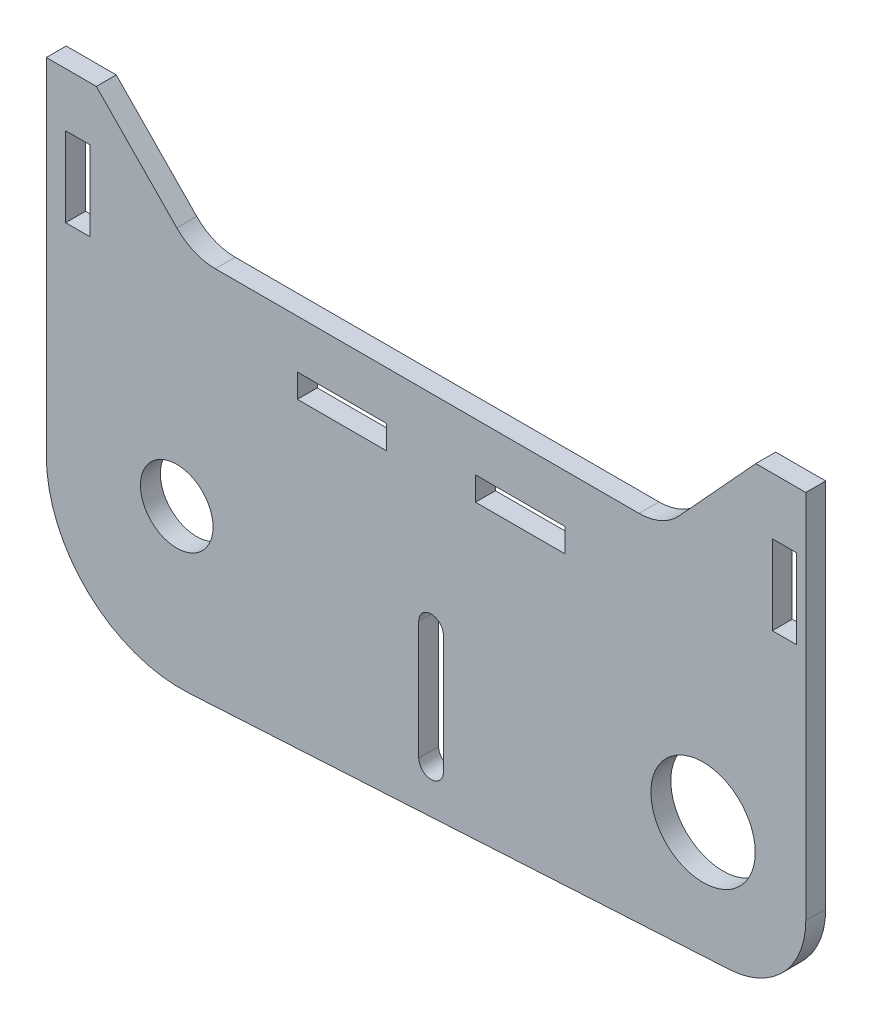
from build123d import *

# Parameters (mm, degrees)
SKETCH2_R           = 9.7
SKETCH2_R_2         = 6.75
SKETCH2_W           = 4.5
SKETCH2_H           = 14.8
SKETCH2_W_2         = 16.6
SKETCH2_H_2         = 4.4
BOSS_EXTRUDE1_DEPTH = 3.7
FILLET1_R           = 15
FILLET2_R           = 25
FILLET3_R           = 10


with BuildPart() as part:
    # Sketch2 → Boss-Extrude1 (new body)
    with BuildSketch(Plane.XY):
        Polygon((-66.408376963, -37.473298429), (-66.408376963, 53.126701571), (-57.108376963, 53.126701571), (-39.206701064, 34.826701571), (48.193298936, 34.826701571), (65.490462758, 53.699118578), (74.790462758, 53.699118578), (74.790462758, -29.400881422), align=None)
        with Locations((55.690462758, -8.957731732)):
            Circle(SKETCH2_R, mode=Mode.SUBTRACT)
        with Locations((-42.158376963, -6.98947646)):
            Circle(SKETCH2_R_2, mode=Mode.SUBTRACT)
        with Locations((-60.558376963, 35.726701571)):
            Rectangle(SKETCH2_W, SKETCH2_H, mode=Mode.SUBTRACT)
        with Locations((70.815419874, 35.726701571)):
            Rectangle(SKETCH2_W, SKETCH2_H, mode=Mode.SUBTRACT)
        with Locations((-11.433419848, 23.626701571)):
            Rectangle(SKETCH2_W_2, SKETCH2_H_2, mode=Mode.SUBTRACT)
        with Locations((21.690462758, 23.626701571)):
            Rectangle(SKETCH2_W_2, SKETCH2_H_2, mode=Mode.SUBTRACT)
        with BuildLine():
            Line((7.428521455, -3.001867406), (7.428521455, -25.037089926))
            ThreePointArc((7.428521455, -25.037089926), (5.128521455, -27.337089926), (2.828521455, -25.037089926))
            Line((2.828521455, -25.037089926), (2.828521455, -3.001867406))
            ThreePointArc((2.828521455, -3.001867406), (5.128521455, -0.701867406), (7.428521455, -3.001867406))
        make_face(mode=Mode.SUBTRACT)
    extrude(amount=BOSS_EXTRUDE1_DEPTH)

    # Fillet1
    fillet1_edges = [part.edges().sort_by_distance(p)[0] for p in [
        (74.790462758, -29.400881422, 1.85),
    ]]
    fillet(fillet1_edges, radius=FILLET1_R)

    # Fillet2
    fillet2_edges = [part.edges().sort_by_distance(p)[0] for p in [
        (-66.408376963, -37.473298429, 1.85),
    ]]
    fillet(fillet2_edges, radius=FILLET2_R)

    # Fillet3
    fillet3_edges = [part.edges().sort_by_distance(p)[0] for p in [
        (-39.206701064, 34.826701571, 1.85),
        (48.193298936, 34.826701571, 1.85),
    ]]
    fillet(fillet3_edges, radius=FILLET3_R)


solid = part.part
